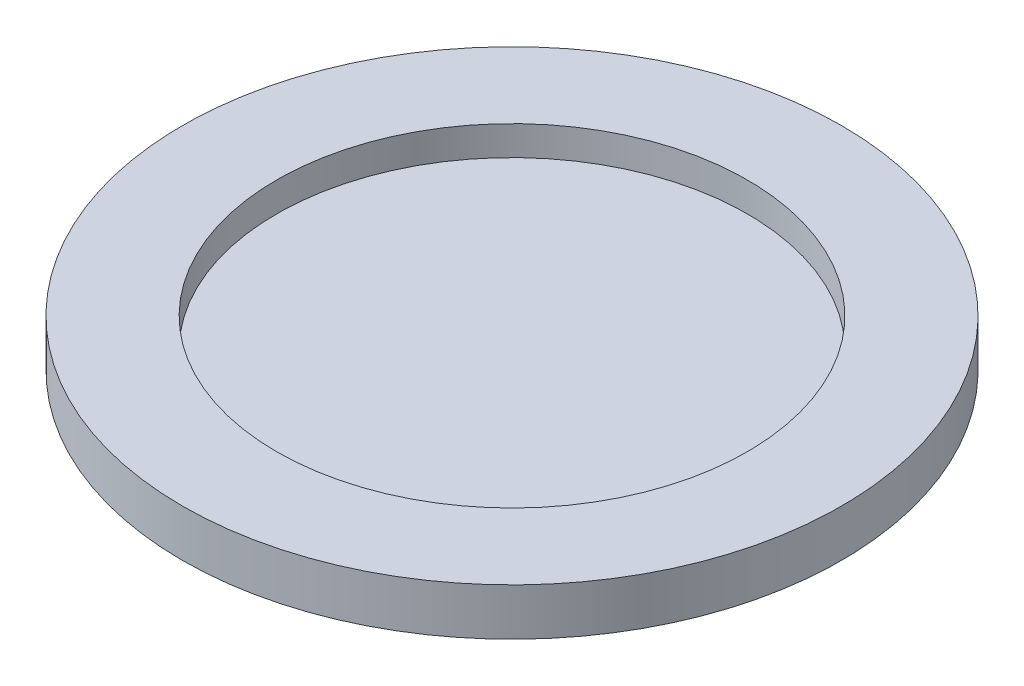
from build123d import *

# Parameters (mm, degrees)
ESBO_O1_R                = 56
ESBO_O1_R_2              = 40
RESSALTO_EXTRUS_O1_DEPTH = 6
RESSALTO_EXTRUS_O2_START = 2
ESBO_O2_R                = 56
RESSALTO_EXTRUS_O2_DEPTH = 2
ESBO_O3_R                = 40
RESSALTO_EXTRUS_O3_DEPTH = 1


with BuildPart() as part:
    # Esboço1 → Ressalto-extrusão1 (new body)
    with BuildSketch(Plane(origin=(0, 0, 0), x_dir=(1, 0, 0), z_dir=(0, 1, 0))):
        with Locations(Location((0, 0, 0), (0, 0, 270))):
            Circle(ESBO_O1_R)
        with Locations(Location((0, 0, 0), (0, 0, 270))):
            Circle(ESBO_O1_R_2, mode=Mode.SUBTRACT)
    extrude(amount=RESSALTO_EXTRUS_O1_DEPTH)

    # Esboço2 → Ressalto-extrusão2 (add)
    with BuildSketch(Plane.XZ.offset(RESSALTO_EXTRUS_O2_START)):
        with Locations(Location((0, 0, 0), (0, 0, 270))):
            Circle(ESBO_O2_R)
    extrude(amount=-RESSALTO_EXTRUS_O2_DEPTH)

    # Esboço3 → Ressalto-extrusão3 (add)
    with BuildSketch(Plane(origin=(0, 0, 0), x_dir=(1, 0, 0), z_dir=(0, 1, 0))):
        with Locations(Location((0, 0, 0), (0, 0, 270))):
            Circle(ESBO_O3_R)
    extrude(amount=RESSALTO_EXTRUS_O3_DEPTH)


solid = part.part
